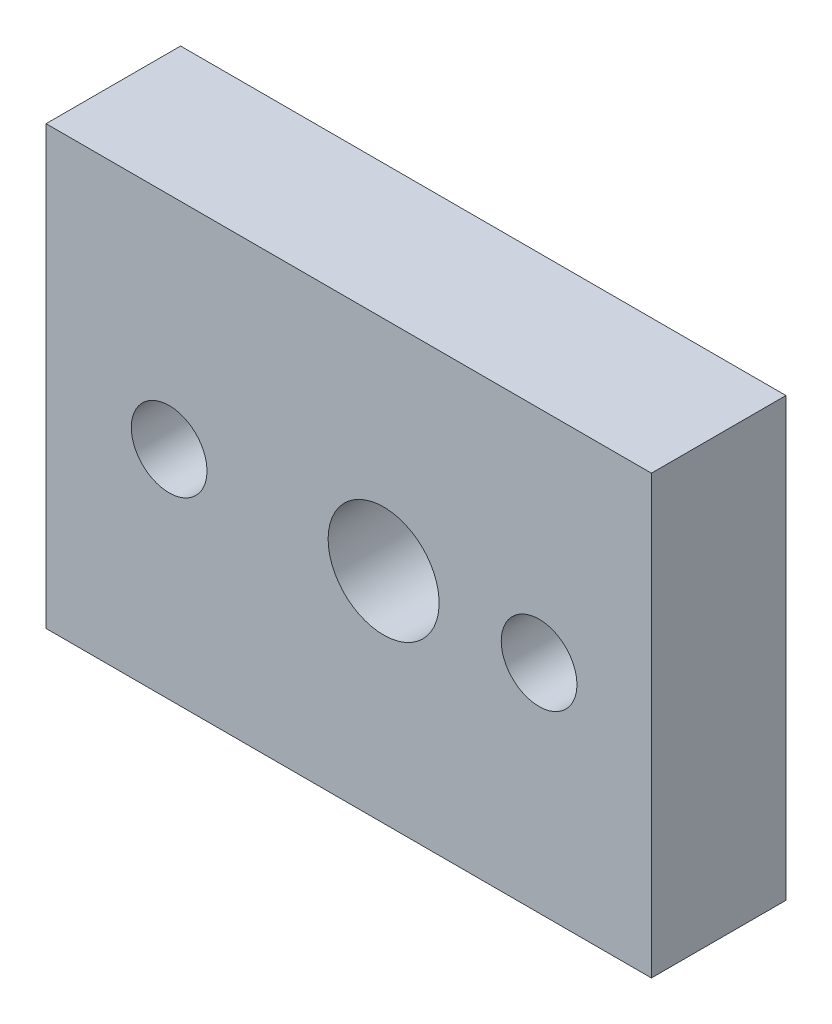
from build123d import *

# Parameters (mm, degrees)
ESQUISSE1_W          = 36
ESQUISSE1_H          = 26
BOSS_EXTRU_1_DEPTH   = 8
D_GAGEMENT_M41_D     = 4.5
M6_CLEARANCE_HOLE2_D = 6.6


with BuildPart() as part:
    # Esquisse1 → Boss.-Extru.1 (new body)
    with BuildSketch(Plane.XY):
        Rectangle(ESQUISSE1_W, ESQUISSE1_H)
    extrude(amount=BOSS_EXTRU_1_DEPTH)

    # Dégagement M41 (through all)
    with Locations(Plane(origin=(0, 0, 0), x_dir=(-1, 0, 0), z_dir=(0, 0, -1))):
        with Locations((-11.318887596, -0.107841378), (10.681112224, -0.10502754)):
            Hole(D_GAGEMENT_M41_D / 2)

    # M6 Clearance Hole2 (through all)
    with Locations(Plane(origin=(0, 0, 0), x_dir=(-1, 0, 0), z_dir=(0, 0, -1))):
        with Locations((-2.073526459, 0)):
            Hole(M6_CLEARANCE_HOLE2_D / 2)


solid = part.part
